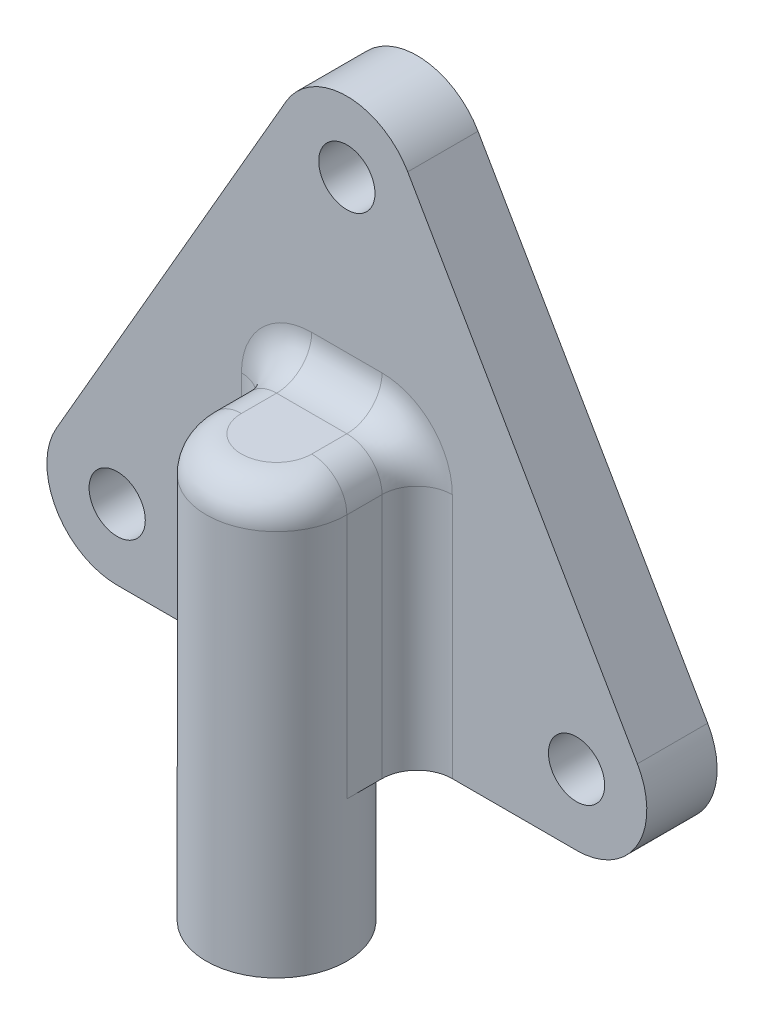
from build123d import *

# Parameters (mm, degrees)
ESTRUSIONE_ESTRUSIONE1_DEPTH = 10
ESTRUSIONE_ESTRUSIONE2_DEPTH = 40
ESTRUSIONE_ESTRUSIONE3_START = 20
ESTRUSIONE_ESTRUSIONE3_DEPTH = 20
FORO_10_0_10_1_D             = 10
FORO_10_0_10_1_DEPTH         = 45
FORO_8_0_8_1_D               = 8
RACCORDO1_R                  = 5
RACCORDO2_R                  = 5


with BuildPart() as part:
    # Schizzo1 → Estrusione-Estrusione1 (new body)
    with BuildSketch(Plane.XY):
        with BuildLine():
            Line((41.339745962, -13.867513459), (8.660254038, 42.735026919))
            ThreePointArc((8.660254038, 42.735026919), (0, 47.735026919), (-8.660254038, 42.735026919))
            Line((-8.660254038, 42.735026919), (-41.339745962, -13.867513459))
            ThreePointArc((-41.339745962, -13.867513459), (-41.339745962, -23.867513459), (-32.679491924, -28.867513459))
            Line((-32.679491924, -28.867513459), (32.679491924, -28.867513459))
            ThreePointArc((32.679491924, -28.867513459), (41.339745962, -23.867513459), (41.339745962, -13.867513459))
        make_face()
    extrude(amount=ESTRUSIONE_ESTRUSIONE1_DEPTH)

    # Schizzo2 → Estrusione-Estrusione2 (add)
    with BuildSketch(Plane.XZ.offset(28.867513459)):
        with BuildLine():
            Line((-10, 10), (10, 10))
            Line((10, 10), (10, 20))
            ThreePointArc((10, 20), (0, 30), (-10, 20))
            Line((-10, 20), (-10, 10))
        make_face()
    extrude(amount=-ESTRUSIONE_ESTRUSIONE2_DEPTH)

    # Schizzo2<3> → Estrusione-Estrusione3 (add)
    with BuildSketch(Plane.XZ.offset(28.867513459).offset(ESTRUSIONE_ESTRUSIONE3_START)):
        with BuildLine():
            ThreePointArc((10, 20), (0, 30), (-10, 20))
            ThreePointArc((-10, 20), (-7.071067812, 12.928932188), (0, 10))
            ThreePointArc((0, 10), (7.071067812, 12.928932188), (10, 20))
        make_face()
    extrude(amount=-ESTRUSIONE_ESTRUSIONE3_DEPTH)

    # Foro Ø10.0 (10)-1
    with Locations(Plane(origin=(0, -48.867513459, 0), x_dir=(-1, 0, 0), z_dir=(0, -1, 0))):
        with Locations((0, -20)):
            Hole(FORO_10_0_10_1_D / 2, depth=FORO_10_0_10_1_DEPTH)

    # Foro Ø8.0 (8)-1 (through all)
    with Locations(Plane.XY.offset(10)):
        with Locations((0, 37.735026919), (-32.679491924, -18.867513459), (32.679491924, -18.867513459)):
            Hole(FORO_8_0_8_1_D / 2)

    # Raccordo1
    raccordo1_edges = [part.edges().sort_by_distance(p)[0] for p in [
        (10, 11.132486541, 15),
        (-10, 11.132486541, 15),
        (0, 11.132486541, 30),
    ]]
    fillet(raccordo1_edges, radius=RACCORDO1_R)

    # Raccordo2
    raccordo2_edges = [part.edges().sort_by_distance(p)[0] for p in [
        (10, -11.367513459, 10),
        (8.535533906, 9.668020446, 10),
        (0, 11.132486541, 10),
        (-8.535533906, 9.668020446, 10),
        (-10, -11.367513459, 10),
    ]]
    fillet(raccordo2_edges, radius=RACCORDO2_R)


solid = part.part
